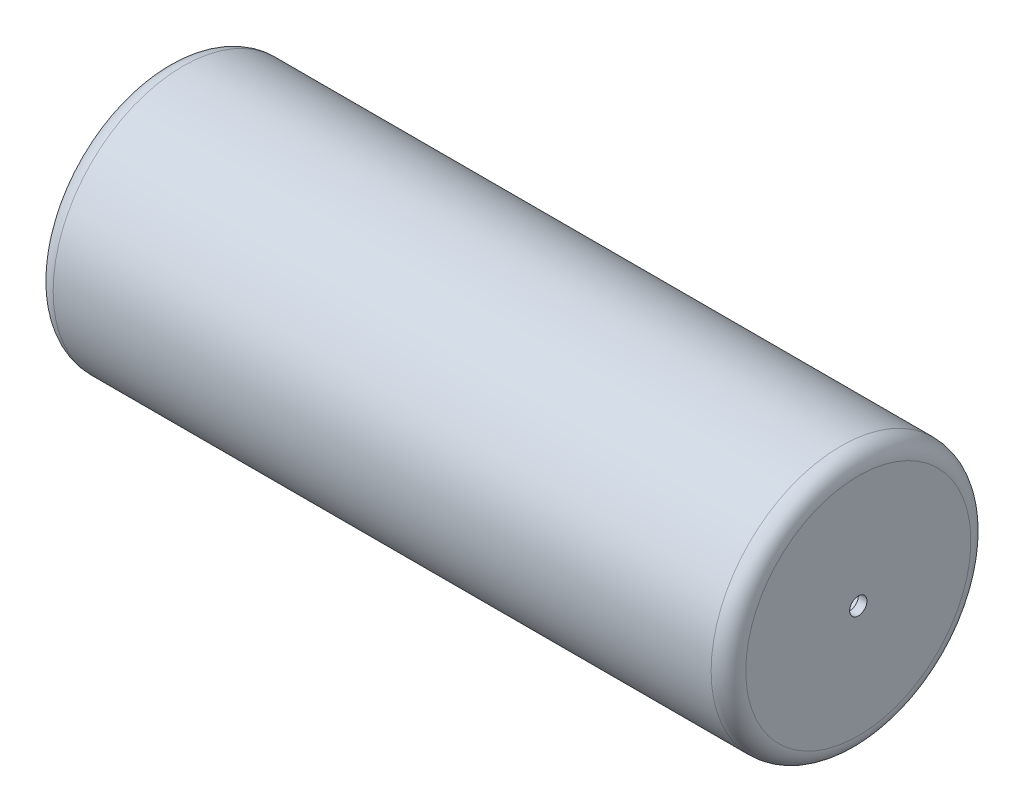
from build123d import *

# Parameters (mm, degrees)
SKETCH1_W          = 80
SKETCH1_H          = 15
SHELL2_T           = 1
SKETCH2_R          = 1
CUT_EXTRUDE1_DEPTH = 10
FILLET1_R          = 2


with BuildPart() as part:
    # Sketch1 → Revolve1 (revolve)
    with BuildSketch(Plane.XY, mode=Mode.PRIVATE) as revolve1_sk:
        with Locations((40, 7.5)):
            Rectangle(SKETCH1_W, SKETCH1_H)
    revolve(revolve1_sk.sketch.rotate(Axis((0, 0, 0), (1, 0, 0)), 90), axis=Axis((0, 0, 0), (1, 0, 0)))

    # Shell2 (no face opened: a closed hollow body)
    add(offset(amount=-SHELL2_T, mode=Mode.PRIVATE), mode=Mode.SUBTRACT)

    # Sketch2 → Cut-Extrude1 (cut)
    with BuildSketch(Plane(origin=(80, 0, 0), x_dir=(0, 0, -1), z_dir=(1, 0, 0))):
        Circle(SKETCH2_R)
    extrude(amount=-CUT_EXTRUDE1_DEPTH, mode=Mode.SUBTRACT)

    # Fillet1
    fillet1_edges = [part.edges().sort_by_distance(p)[0] for p in [
        (0, 0, -15),
        (80, 0, -15),
    ]]
    fillet(fillet1_edges, radius=FILLET1_R)


solid = part.part
